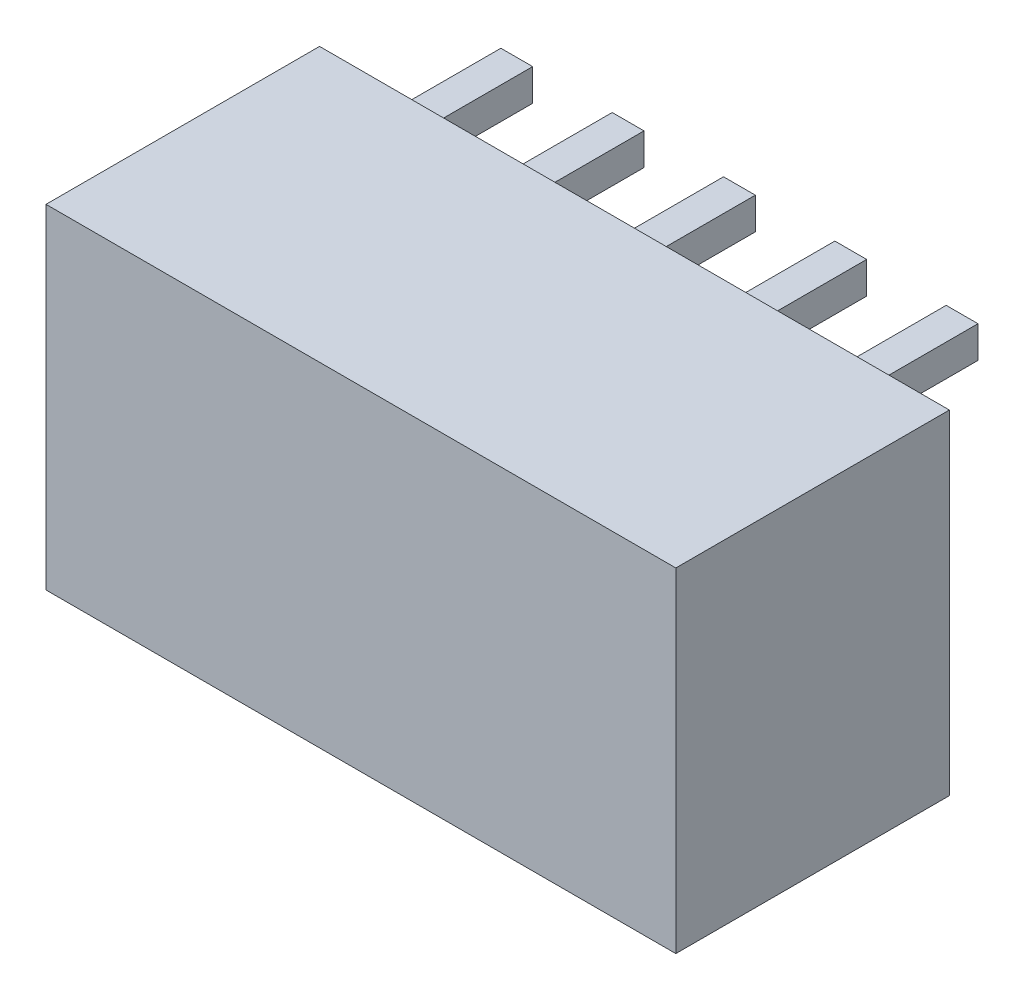
from build123d import *

# Parameters (mm, degrees)
SKETCH_1_W                         = 19.8
SKETCH_1_H                         = 10.5
EXTRUDE_1_DEPTH                    = 8.6
CUT_EXTRUDE_1_DEPTH                = 7
EXTRUDE_START                      = -5
SKETCH_3_W                         = 1
SKETCH_3_H                         = 1
EXTRUDE_2_DEPTH                    = 8.6
CHAMFER_1_SIZE                     = 0.3
PATTERN_LINEAR_1_COUNT             = 5
PATTERN_LINEAR_1_PITCH             = 3.5
CHAMFER_1_OF_PATTERN_LINEAR_1_SIZE = 0.3


with BuildPart() as part:
    # Эскиз1 → Бобышка-Вытянуть1 (new body)
    with BuildSketch(Plane.XY):
        Rectangle(SKETCH_1_W, SKETCH_1_H)
    extrude(amount=EXTRUDE_1_DEPTH)

    # Эскиз2 → Вырез-Вытянуть1 (cut)
    with BuildSketch(Plane.XZ.offset(5.25)):
        Polygon((-8.9, 6.6), (8.9, 6.6), (8.9, 0.2), (6.7, 0.2), (6.7, 1.8), (-5.1, 1.8), (-5.1, 0.2), (-7.3, 0.2), (-7.3, 1.8), (-8.9, 1.8), align=None)
    extrude(amount=-CUT_EXTRUDE_1_DEPTH, mode=Mode.SUBTRACT)

    # Эскиз3 → Бобышка-Вытянуть2 (add)
    with BuildSketch(Plane(origin=(0, 0, 0), x_dir=(-1, 0, 0), z_dir=(0, 0, -1)).offset(EXTRUDE_START)):
        with Locations((7, 4.25)):
            Rectangle(SKETCH_3_W, SKETCH_3_H)
    extrude_2 = extrude(amount=EXTRUDE_2_DEPTH)

    # Фаска1
    chamfer_1_edges = [part.edges().sort_by_distance(p)[0] for p in [
        (-6.5, 4.25, -3.6),
        (-7, 3.75, -3.6),
        (-7.5, 4.25, -3.6),
        (-7, 4.75, -3.6),
    ]]
    chamfer(chamfer_1_edges, length=CHAMFER_1_SIZE)

    # Линейный массив1: Бобышка-Вытянуть2 ×5
    with Locations(*[(i * PATTERN_LINEAR_1_PITCH, 0, 0) for i in range(1, PATTERN_LINEAR_1_COUNT)]):
        add(extrude_2)

    # Фаска1 of Линейный массив1
    chamfer_1_of_pattern_linear_1_edges = [part.edges().sort_by_distance(p)[0] for p in [
        (-3, 4.25, -3.6),
        (-3.5, 3.75, -3.6),
        (-4, 4.25, -3.6),
        (-3.5, 4.75, -3.6),
        (0.5, 4.25, -3.6),
        (0, 3.75, -3.6),
        (-0.5, 4.25, -3.6),
        (0, 4.75, -3.6),
        (4, 4.25, -3.6),
        (3.5, 3.75, -3.6),
        (3, 4.25, -3.6),
        (3.5, 4.75, -3.6),
        (7.5, 4.25, -3.6),
        (7, 3.75, -3.6),
        (6.5, 4.25, -3.6),
        (7, 4.75, -3.6),
    ]]
    chamfer(chamfer_1_of_pattern_linear_1_edges, length=CHAMFER_1_OF_PATTERN_LINEAR_1_SIZE)


solid = part.part
